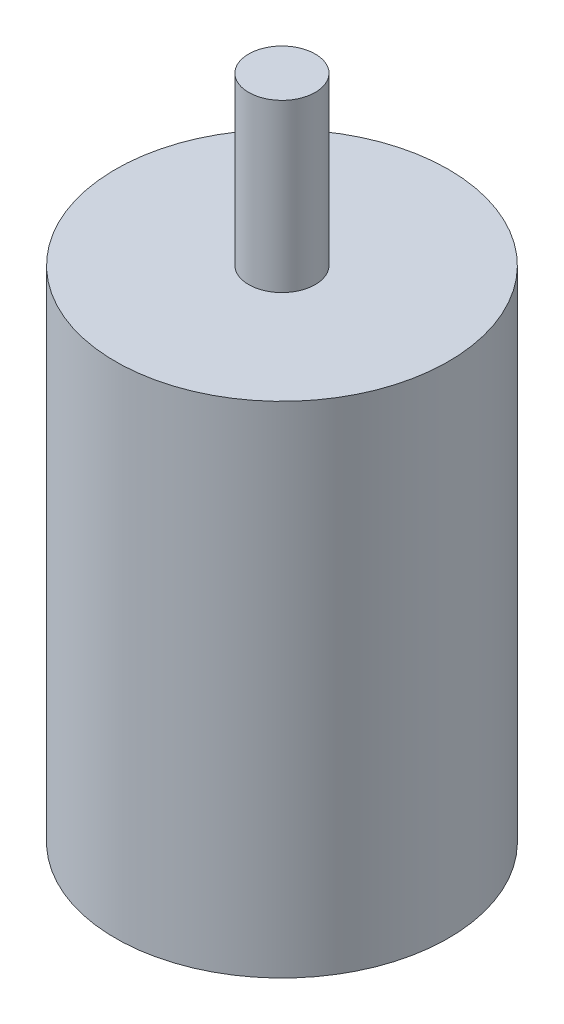
from build123d import *

# Parameters (mm, degrees)
SKETCH1_R           = 6.35
BOSS_EXTRUDE1_DEPTH = 19.05
SKETCH2_R           = 1.27
BOSS_EXTRUDE2_DEPTH = 6.35


with BuildPart() as part:
    # Sketch1 → Boss-Extrude1 (new body)
    with BuildSketch(Plane(origin=(0, 0, 0), x_dir=(1, 0, 0), z_dir=(0, 1, 0))):
        with Locations(Location((0, 0, 0), (0, 0, 90))):
            Circle(SKETCH1_R)
    extrude(amount=BOSS_EXTRUDE1_DEPTH)

    # Sketch2 → Boss-Extrude2 (add)
    with BuildSketch(Plane(origin=(0, 19.05, 0), x_dir=(1, 0, 0), z_dir=(0, 1, 0))):
        with Locations(Location((0, 0, 0), (0, 0, 270))):
            Circle(SKETCH2_R)
    extrude(amount=BOSS_EXTRUDE2_DEPTH)


solid = part.part
